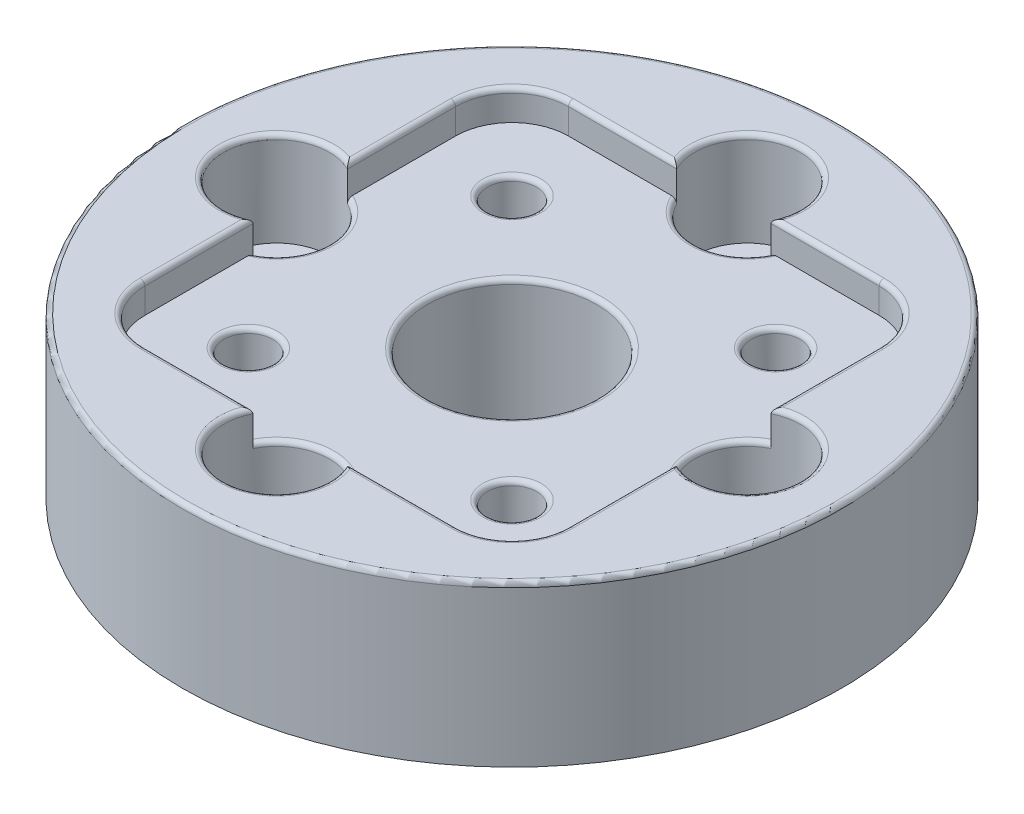
from build123d import *

# Parameters (mm, degrees)
SKETCH1_R           = 17.5
SKETCH1_R_2         = 1.5
SKETCH1_R_3         = 4.5
BOSS_EXTRUDE1_DEPTH = 8.5
SKETCH3_R           = 2.8
CUT_EXTRUDE2_DEPTH  = 5
SKETCH2_W           = 22.5
SKETCH2_H           = 22.5
CUT_EXTRUDE1_DEPTH  = 1.6
CUT_EXTRUDE3_REACH  = 27.693
SKETCH4_R           = 1.3
FILLET2_R           = 3
FILLET1_R           = 0.25


with BuildPart() as part:
    # Sketch1 → Boss-Extrude1 (new body)
    with BuildSketch(Plane(origin=(0, 0, 0), x_dir=(1, 0, 0), z_dir=(0, 1, 0))):
        with Locations(Location((0, 0, 0), (0, 0, 270))):
            Circle(SKETCH1_R)
        with Locations(Location((0, 12.5, 0), (0, 0, 270))):
            Circle(SKETCH1_R_2, mode=Mode.SUBTRACT)
        with Locations(Location((12.5, 0, 0), (0, 0, 270))):
            Circle(SKETCH1_R_2, mode=Mode.SUBTRACT)
        with Locations(Location((0, -12.5, 0), (0, 0, 270))):
            Circle(SKETCH1_R_2, mode=Mode.SUBTRACT)
        with Locations(Location((-12.5, 0, 0), (0, 0, 270))):
            Circle(SKETCH1_R_2, mode=Mode.SUBTRACT)
        with Locations(Location((0, 0, 0), (0, 0, 270))):
            Circle(SKETCH1_R_3, mode=Mode.SUBTRACT)
    extrude(amount=BOSS_EXTRUDE1_DEPTH)

    # Sketch3 → Cut-Extrude2 (cut)
    with BuildSketch(Plane(origin=(0, 8.5, 0), x_dir=(1, 0, 0), z_dir=(0, 1, 0))):
        with Locations(Location((0, 12.5, 0), (0, 0, 270))):
            Circle(SKETCH3_R)
        with Locations(Location((12.5, 0, 0), (0, 0, 270))):
            Circle(SKETCH3_R)
        with Locations(Location((0, -12.5, 0), (0, 0, 270))):
            Circle(SKETCH3_R)
        with Locations(Location((-12.5, 0, 0), (0, 0, 270))):
            Circle(SKETCH3_R)
    extrude(amount=-CUT_EXTRUDE2_DEPTH, mode=Mode.SUBTRACT)

    # Sketch2 → Cut-Extrude1 (cut)
    with BuildSketch(Plane(origin=(0, 8.5, 0), x_dir=(1, 0, 0), z_dir=(0, 1, 0))):
        Rectangle(SKETCH2_W, SKETCH2_H)
    extrude(amount=-CUT_EXTRUDE1_DEPTH, mode=Mode.SUBTRACT)

    # Sketch4 → Cut-Extrude3 (cut, up to next)
    with BuildSketch(Plane(origin=(0, 6.9, 0), x_dir=(1, 0, 0), z_dir=(0, 1, 0)), mode=Mode.PRIVATE) as cut_extrude3_sk1:
        with Locations(Location((7, 7, 0), (0, 0, 270))):
            Circle(SKETCH4_R)
    cut_extrude3_tool1 = extrude(cut_extrude3_sk1.sketch, amount=-CUT_EXTRUDE3_REACH, mode=Mode.PRIVATE) & part.part
    # Sketch4 → Cut-Extrude3 (cut, up to next)
    with BuildSketch(Plane(origin=(0, 6.9, 0), x_dir=(1, 0, 0), z_dir=(0, 1, 0)), mode=Mode.PRIVATE) as cut_extrude3_sk2:
        with Locations(Location((-7, 7, 0), (0, 0, 270))):
            Circle(SKETCH4_R)
    cut_extrude3_tool2 = extrude(cut_extrude3_sk2.sketch, amount=-CUT_EXTRUDE3_REACH, mode=Mode.PRIVATE) & part.part
    # Sketch4 → Cut-Extrude3 (cut, up to next)
    with BuildSketch(Plane(origin=(0, 6.9, 0), x_dir=(1, 0, 0), z_dir=(0, 1, 0)), mode=Mode.PRIVATE) as cut_extrude3_sk3:
        with Locations(Location((7, -7, 0), (0, 0, 270))):
            Circle(SKETCH4_R)
    cut_extrude3_tool3 = extrude(cut_extrude3_sk3.sketch, amount=-CUT_EXTRUDE3_REACH, mode=Mode.PRIVATE) & part.part
    # Sketch4 → Cut-Extrude3 (cut, up to next)
    with BuildSketch(Plane(origin=(0, 6.9, 0), x_dir=(1, 0, 0), z_dir=(0, 1, 0)), mode=Mode.PRIVATE) as cut_extrude3_sk4:
        with Locations(Location((-7, -7, 0), (0, 0, 270))):
            Circle(SKETCH4_R)
    cut_extrude3_tool4 = extrude(cut_extrude3_sk4.sketch, amount=-CUT_EXTRUDE3_REACH, mode=Mode.PRIVATE) & part.part
    add(cut_extrude3_tool1.solids().sort_by_distance((7, 6.9, -7))[0], mode=Mode.SUBTRACT)
    add(cut_extrude3_tool2.solids().sort_by_distance((-7, 6.9, -7))[0], mode=Mode.SUBTRACT)
    add(cut_extrude3_tool3.solids().sort_by_distance((7, 6.9, 7))[0], mode=Mode.SUBTRACT)
    add(cut_extrude3_tool4.solids().sort_by_distance((-7, 6.9, 7))[0], mode=Mode.SUBTRACT)

    # Fillet2
    fillet2_edges = [part.edges().sort_by_distance(p)[0] for p in [
        (-11.25, 7.7, 11.25),
        (11.25, 7.7, 11.25),
        (11.25, 7.7, -11.25),
        (-11.25, 7.7, -11.25),
    ]]
    fillet(fillet2_edges, radius=FILLET2_R)

    # Fillet1
    fillet1_edges = [part.edges().sort_by_distance(p)[0] for p in [
        (-5.377746982, 8.5, 11.25),
        (11.25, 8.5, 5.377746982),
        (5.377746982, 8.5, -11.25),
        (-11.25, 8.5, -5.377746982),
        (-10.371320344, 8.5, 10.371320344),
        (10.371320344, 8.5, 10.371320344),
        (10.371320344, 8.5, -10.371320344),
        (-10.371320344, 8.5, -10.371320344),
        (0, 8.5, -15.3),
        (0, 8.5, -17.5),
        (1.473091986, 6.9, -10.11882382),
        (15.225379157, 8.5, -0.642112491),
        (2.38117618, 8.5, 13.973091986),
        (-15.225379157, 8.5, -0.642112491),
        (0, 6.9, -4.5),
        (-9.7, 6.9, 0),
        (9.7, 6.9, 0),
        (0, 6.9, 9.7),
        (-11.25, 8.5, 5.377746982),
        (5.377746982, 8.5, 11.25),
        (11.25, 8.5, -5.377746982),
        (-5.377746982, 8.5, -11.25),
        (-7, 6.9, -8.3),
        (7, 6.9, 5.7),
        (-7, 6.9, 5.7),
        (7, 6.9, -8.3),
    ]]
    fillet(fillet1_edges, radius=FILLET1_R)


solid = part.part
